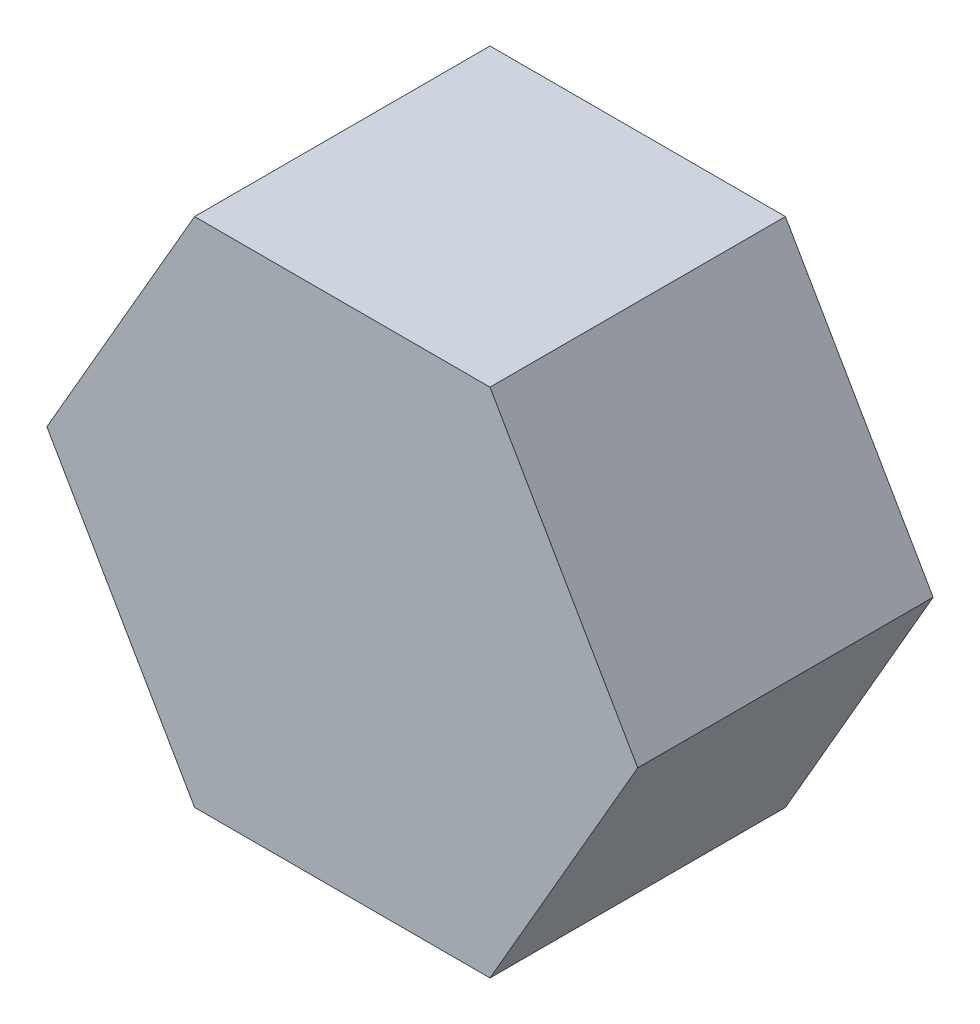
from build123d import *

# Parameters (mm, degrees)
BOSS_EXTRUDE5_DEPTH = 25


with BuildPart() as part:
    # Sketch6 → Boss-Extrude5 (new body)
    with BuildSketch(Plane.XY):
        Polygon((0, 0), (25, 0), (37.5, -21.650635095), (25, -43.301270189), (0, -43.301270189), (-12.5, -21.650635095), align=None)
    extrude(amount=BOSS_EXTRUDE5_DEPTH)


solid = part.part
